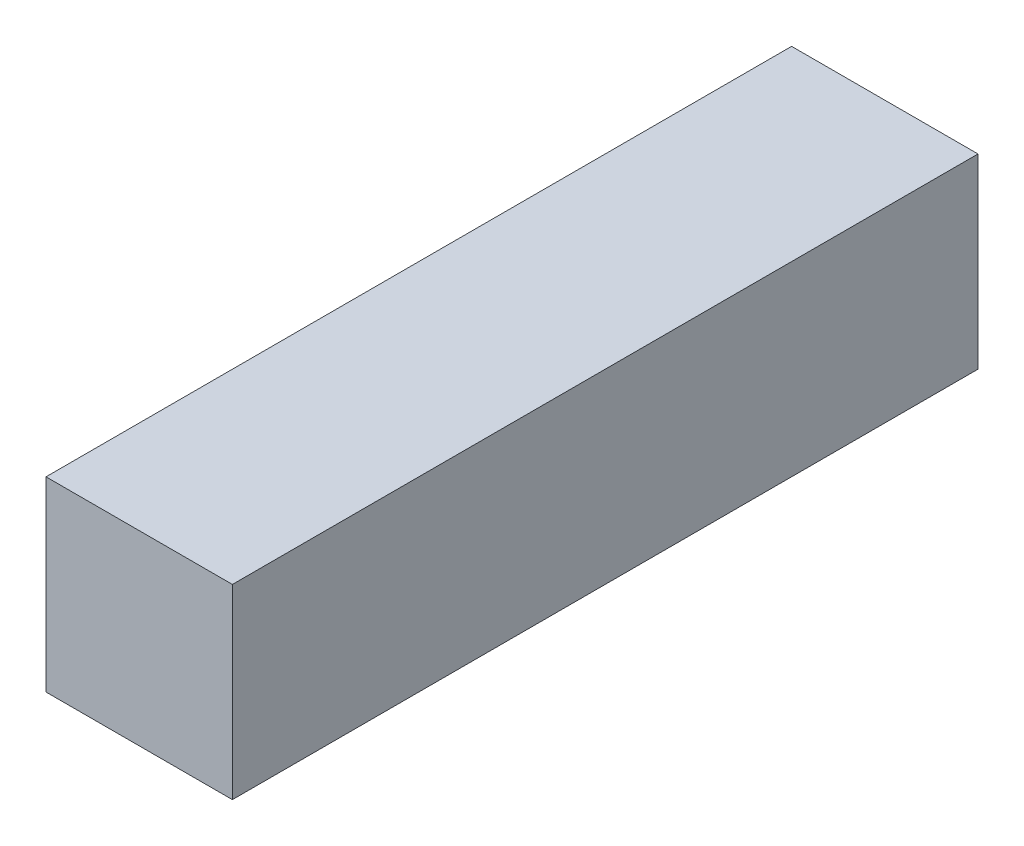
from build123d import *

# Parameters (mm, degrees)
ESQUISSE1_W        = 100
ESQUISSE1_H        = 100
BOSS_EXTRU_1_DEPTH = 400


with BuildPart() as part:
    # Esquisse1 → Boss.-Extru.1 (new body)
    with BuildSketch(Plane.XY):
        with Locations((50, 50)):
            Rectangle(ESQUISSE1_W, ESQUISSE1_H)
    extrude(amount=BOSS_EXTRU_1_DEPTH)


solid = part.part
